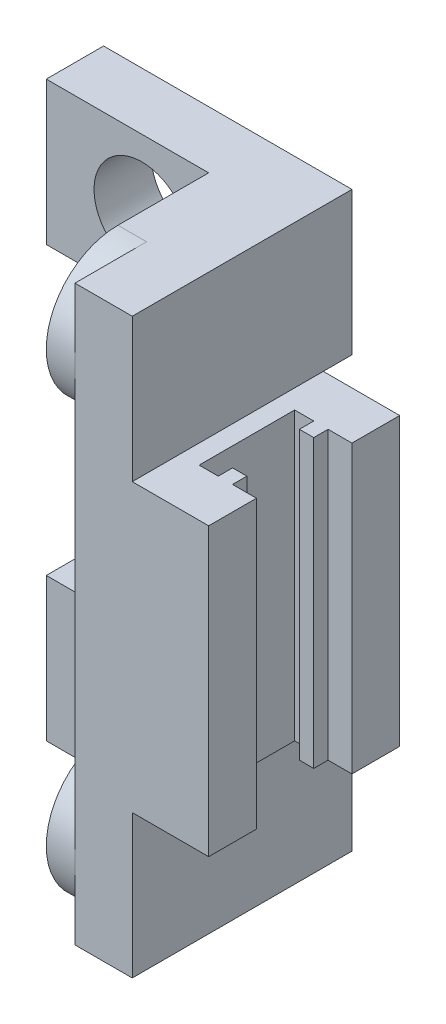
from build123d import *

# Parameters (mm, degrees)
SKETCH_1_W          = 6
SKETCH_1_H          = 60
EXTRUDE_1_DEPTH     = 20
SKETCH_2_W          = 5
SKETCH_2_H          = 30
EXTRUDE_2_DEPTH     = 8
SKETCH_3_W          = 10
SKETCH_3_H          = 30
EXTRUDE_3_DEPTH     = 2
SKETCH_4_W          = 1.5
SKETCH_4_H          = 1.5
EXTRUDE_4_DEPTH     = 30
SKETCH_6_W          = 20
SKETCH_6_H          = 15
EXTRUDE_5_DEPTH     = 3
SKETCH_7_R          = 5
CUT_EXTRUDE_1_DEPTH = 42.448763552
SKETCH_8_R          = 7.5
SKETCH_8_R_2        = 5
SKETCH_8_R_3        = 7.459139247
EXTRUDE_7_DEPTH     = 3
CUT_EXTRUDE_START   = -1
SKETCH_10_R         = 5
CUT_EXTRUDE_3_DEPTH = 1
SKETCH_11_W         = 26
SKETCH_11_H         = 15
EXTRUDE_8_DEPTH     = 3
SKETCH_12_R         = 5
CUT_EXTRUDE_4_DEPTH = 3


with BuildPart() as part:
    # 草图1 → 凸台-拉伸1 (new body)
    with BuildSketch(Plane.XY):
        Rectangle(SKETCH_1_W, SKETCH_1_H)
    extrude(amount=EXTRUDE_1_DEPTH)

    # 草图2 → 凸台-拉伸2 (add)
    with BuildSketch(Plane(origin=(3, 0, 0), x_dir=(0, 0, -1), z_dir=(1, 0, 0))):
        with Locations((-17.5, 0)):
            Rectangle(SKETCH_2_W, SKETCH_2_H)
        with Locations((-2.5, 0)):
            Rectangle(SKETCH_2_W, SKETCH_2_H)
    extrude(amount=EXTRUDE_2_DEPTH)

    # 草图3 → 凸台-拉伸3 (add)
    with BuildSketch(Plane(origin=(3, 0, 0), x_dir=(0, 0, -1), z_dir=(1, 0, 0))):
        with Locations((-10, 0)):
            Rectangle(SKETCH_3_W, SKETCH_3_H)
    extrude(amount=EXTRUDE_3_DEPTH)

    # 草图4 → 凸台-拉伸4 (add)
    with BuildSketch(Plane.XZ.offset(15)):
        with Locations((7.75, 14.25)):
            Rectangle(SKETCH_4_W, SKETCH_4_H)
        with Locations((7.75, 5.75)):
            Rectangle(SKETCH_4_W, SKETCH_4_H)
    extrude(amount=-EXTRUDE_4_DEPTH)

    # 草图6 → 凸台-拉伸5 (add)
    with BuildSketch(Plane(origin=(0, 0, 0), x_dir=(-1, 0, 0), z_dir=(0, 0, -1))):
        with Locations((13, 22.5)):
            Rectangle(SKETCH_6_W, SKETCH_6_H)
        with Locations((13, -22.5)):
            Rectangle(SKETCH_6_W, SKETCH_6_H)
    extrude(amount=-EXTRUDE_5_DEPTH)

    # 草图7 → 切除-拉伸1 (cut, through all)
    with BuildSketch(Plane.XY.offset(3)):
        with Locations((-13, -22.5)):
            Circle(SKETCH_7_R)
        with Locations((-13, 22.5)):
            Circle(SKETCH_7_R)
    extrude(amount=-CUT_EXTRUDE_1_DEPTH, mode=Mode.SUBTRACT)

    # 草图8 → 凸台-拉伸7 (add)
    # profile 1 of 4: a face of its own
    with BuildSketch(Plane.ZY.offset(3)):
        with Locations((12.5, 22.5)):
            Circle(SKETCH_8_R)
        with Locations((12.5, 22.5)):
            Circle(SKETCH_8_R_2, mode=Mode.SUBTRACT)
    # profile 2 of 4: a face of its own
    with BuildSketch(Plane.ZY.offset(3)):
        with BuildLine():
            Line((12.5, 30), (3, 30))
            Line((3, 30), (3, 15))
            Line((3, 15), (12.5, 15))
            ThreePointArc((12.5, 15), (5, 22.5), (12.5, 30))
        make_face()
    # profile 3 of 4: a face of its own
    with BuildSketch(Plane.ZY.offset(3)):
        with BuildLine():
            Line((12.540860753, -15.081721505), (3, -15.081721505))
            Line((3, -15.081721505), (3, -30))
            Line((3, -30), (12.540860753, -30))
            ThreePointArc((12.540860753, -30), (5.081721505, -22.540860753), (12.540860753, -15.081721505))
        make_face()
    # profile 4 of 4: a face of its own
    with BuildSketch(Plane.ZY.offset(3)):
        with Locations((12.540860753, -22.540860753)):
            Circle(SKETCH_8_R_3)
        with Locations((12.540860753, -22.540860753)):
            Circle(SKETCH_8_R_2, mode=Mode.SUBTRACT)
    extrude(amount=EXTRUDE_7_DEPTH)

    # 草图10 → 切除-拉伸3 (cut)
    with BuildSketch(Plane.ZY.offset(3).offset(CUT_EXTRUDE_START)):
        with Locations((12.5, 22.5)):
            Circle(SKETCH_10_R)
        with Locations((12.540860753, -22.540860753)):
            Circle(SKETCH_10_R)
    extrude(amount=CUT_EXTRUDE_3_DEPTH, mode=Mode.SUBTRACT)

    # 草图11 → 凸台-拉伸8 (add)
    with BuildSketch(Plane(origin=(0, 0, 0), x_dir=(-1, 0, 0), z_dir=(0, 0, -1))):
        with Locations((10, 22.5)):
            Rectangle(SKETCH_11_W, SKETCH_11_H)
        with Locations((10, -22.5)):
            Rectangle(SKETCH_11_W, SKETCH_11_H)
    extrude(amount=EXTRUDE_8_DEPTH)

    # 草图12 → 切除-拉伸4 (cut)
    with BuildSketch(Plane.XY):
        with Locations((-13, 22.5)):
            Circle(SKETCH_12_R)
        with Locations((-13, -22.5)):
            Circle(SKETCH_12_R)
    extrude(amount=-CUT_EXTRUDE_4_DEPTH, mode=Mode.SUBTRACT)


solid = part.part
